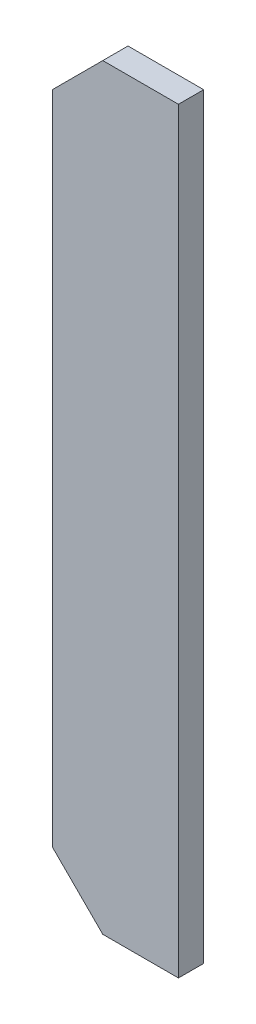
from build123d import *

# Parameters (mm, degrees)
SKETCH_1_W      = 25
SKETCH_1_H      = 150
EXTRUDE_1_DEPTH = 2.5
CHAMFER_1_SIZE  = 10


with BuildPart() as part:
    # Эскиз1 → Бобышка-Вытянуть1 (new, symmetric)
    with BuildSketch(Plane.XY):
        with Locations((12.5, 75)):
            Rectangle(SKETCH_1_W, SKETCH_1_H)
    extrude(amount=EXTRUDE_1_DEPTH, both=True)

    # Фаска1
    chamfer_1_edges = [part.edges().sort_by_distance(p)[0] for p in [
        (0, 0, 0),
        (0, 150, 0),
    ]]
    chamfer(chamfer_1_edges, length=CHAMFER_1_SIZE)


solid = part.part
